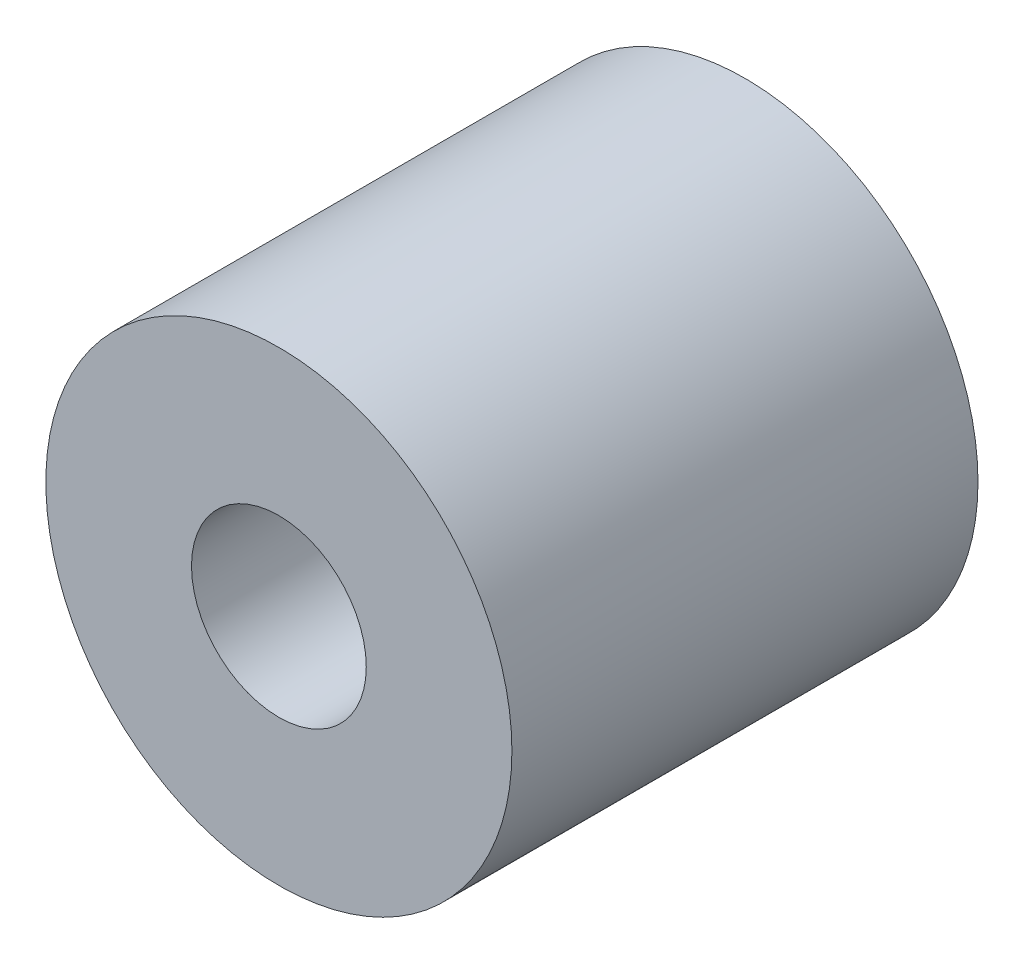
from build123d import *

# Parameters (mm, degrees)
SKETCH1_R           = 4
SKETCH1_R_2         = 3.075
BOSS_EXTRUDE1_DEPTH = 8
BOSS_EXTRUDE2_START = -5.5
SKETCH2_R           = 3.075
SKETCH2_R_2         = 1.5
BOSS_EXTRUDE2_DEPTH = 5.5


with BuildPart() as part:
    # Sketch1 → Boss-Extrude1 (new body)
    with BuildSketch(Plane.XY):
        Circle(SKETCH1_R)
        Circle(SKETCH1_R_2, mode=Mode.SUBTRACT)
    extrude(amount=BOSS_EXTRUDE1_DEPTH)

    # Sketch2 → Boss-Extrude2 (add)
    with BuildSketch(Plane.XY.offset(8).offset(BOSS_EXTRUDE2_START)):
        Circle(SKETCH2_R)
        Circle(SKETCH2_R_2, mode=Mode.SUBTRACT)
    extrude(amount=BOSS_EXTRUDE2_DEPTH)


solid = part.part
